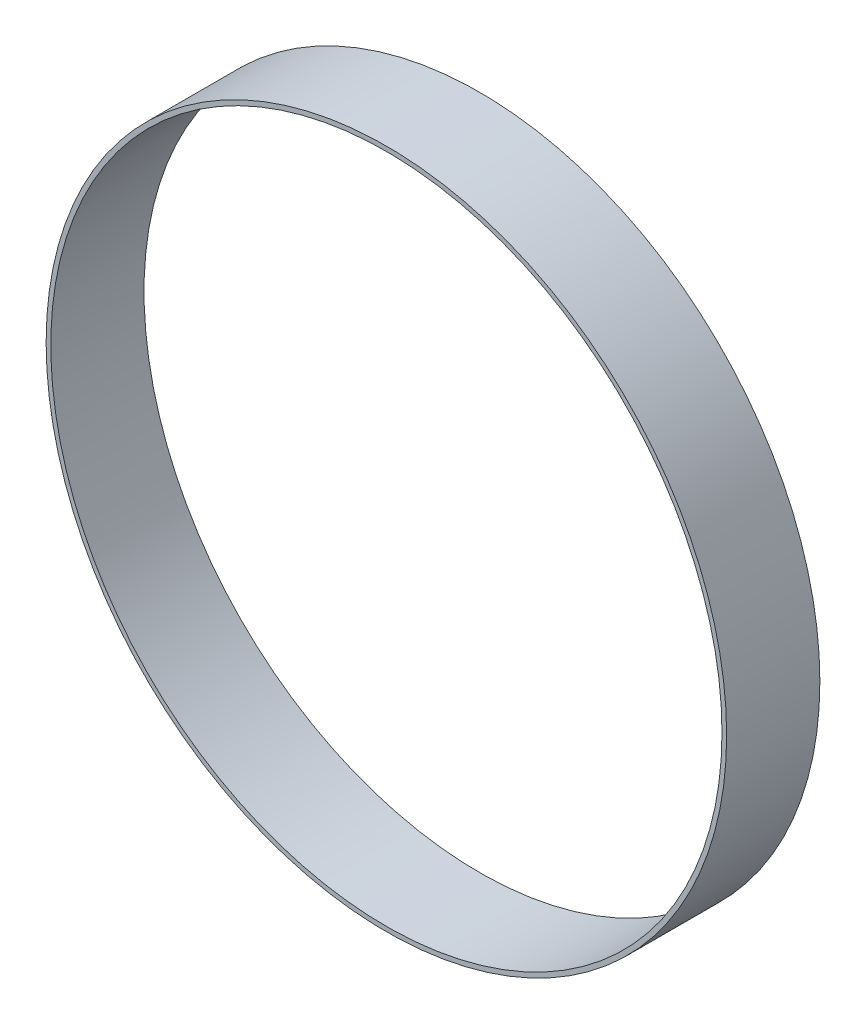
from build123d import *

# Parameters (mm, degrees)
SKETCH1_R           = 73
SKETCH1_R_2         = 72
BOSS_EXTRUDE1_DEPTH = 20


with BuildPart() as part:
    # Sketch1 → Boss-Extrude1 (new body)
    with BuildSketch(Plane.XY):
        Circle(SKETCH1_R)
        Circle(SKETCH1_R_2, mode=Mode.SUBTRACT)
    extrude(amount=BOSS_EXTRUDE1_DEPTH)


solid = part.part
